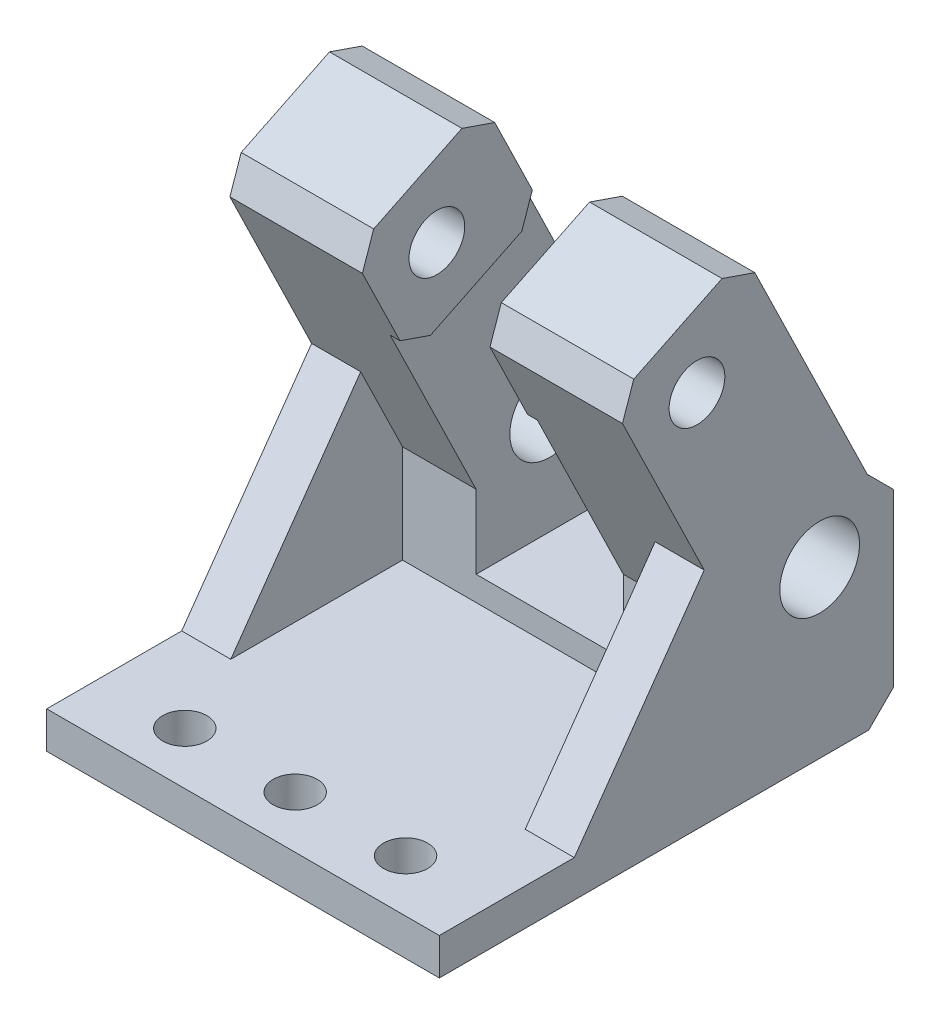
from build123d import *

# Parameters (mm, degrees)
EXTRUDE_1_DEPTH     = 12
SKETCH_2_W          = 32
SKETCH_2_H          = 3
EXTRUDE_2_DEPTH     = 25
SKETCH_3_R          = 3.25
CUT_EXTRUDE_1_DEPTH = 38
SKETCH_4_R          = 2.271913659
EXTRUDE_3_DEPTH     = 10
CHAMFER_2_SIZE      = 2
CHAMFER_3_SIZE      = 2
EXTRUDE_4_DEPTH     = 4
CHAMFER_4_SIZE      = 2
SKETCH_6_R          = 1.8
CUT_EXTRUDE_2_DEPTH = 8
EXTRUDE_5_DEPTH     = 0.8
SKETCH_8_R          = 2.271913659
CUT_EXTRUDE_3_DEPTH = 23


with BuildPart() as part:
    # 草图1 → 凸台-拉伸1 (new body)
    with BuildSketch(Plane.XY):
        Polygon((16, 0), (-16, 0), (-16, 18), (-6, 18), (-6, 5), (6, 5), (6, 18), (16, 18), align=None)
    extrude(amount=EXTRUDE_1_DEPTH)

    # 草图2 → 凸台-拉伸2 (add)
    with BuildSketch(Plane.XY.offset(12)):
        with Locations((0, 1.5)):
            Rectangle(SKETCH_2_W, SKETCH_2_H)
    extrude(amount=EXTRUDE_2_DEPTH)

    # 草图3 → 切除-拉伸1 (cut)
    with BuildSketch(Plane.ZY.offset(16)):
        with Locations((6, 13.5)):
            Circle(SKETCH_3_R)
    extrude(amount=-CUT_EXTRUDE_1_DEPTH, mode=Mode.SUBTRACT)

    # 草图4 → 凸台-拉伸3 (add)
    with BuildSketch(Plane.ZY.offset(16)):
        Polygon((2.061755591, 18), (12.158971032, 38.730393582), (22.947301651, 33.47568879), (12, 11), (12, 18), align=None)
        with Locations((16, 30.820508076)):
            Circle(SKETCH_4_R, mode=Mode.SUBTRACT)
    extrude_3 = extrude(amount=-EXTRUDE_3_DEPTH)

    # 镜向1: 凸台-拉伸3 across plane
    add(extrude_3.mirror(Plane(origin=(0, 0, 0), x_dir=(0, 0, 1), z_dir=(1, 0, 0))))

    # 倒角2
    chamfer_2_edges = [part.edges().sort_by_distance(p)[0] for p in [
        (11, 18, 0),
        (-11, 18, 0),
    ]]
    chamfer(chamfer_2_edges, length=CHAMFER_2_SIZE)

    # 倒角3
    chamfer_3_edges = [part.edges().sort_by_distance(p)[0] for p in [
        (-11, 38.730393582, 12.158971032),
        (-11, 33.47568879, 22.947301651),
        (11, 33.47568879, 22.947301651),
        (11, 38.730393582, 12.158971032),
    ]]
    chamfer(chamfer_3_edges, length=CHAMFER_3_SIZE)

    # 草图5 → 凸台-拉伸4 (add)
    with BuildSketch(Plane.ZY.offset(16)):
        Polygon((15.409511151, 18), (26, 3), (12, 3), (12, 11), align=None)
    extrude_4 = extrude(amount=-EXTRUDE_4_DEPTH)

    # 镜向2: 凸台-拉伸4 across plane
    add(extrude_4.mirror(Plane(origin=(0, 0, 0), x_dir=(0, 0, 1), z_dir=(1, 0, 0))))

    # 倒角4
    chamfer_4_edges = [part.edges().sort_by_distance(p)[0] for p in [
        (0, 0, 0),
    ]]
    chamfer(chamfer_4_edges, length=CHAMFER_4_SIZE)

    # 草图6 → 切除-拉伸2 (cut)
    with BuildSketch(Plane(origin=(0, 3, 0), x_dir=(1, 0, 0), z_dir=(0, 1, 0))):
        with Locations(Location((0, -32.750411326, 0), (0, 0, 270))):
            Circle(SKETCH_6_R)
        with Locations(Location((-9, -32.750411326, 0), (0, 0, 270))):
            Circle(SKETCH_6_R)
        with Locations(Location((9, -32.750411326, 0), (0, 0, 180))):
            Circle(SKETCH_6_R)
    extrude(amount=-CUT_EXTRUDE_2_DEPTH, mode=Mode.SUBTRACT)

    # 草图7 → 凸台-拉伸5 (add)
    with BuildSketch(Plane.ZY.offset(-6)):
        Polygon((11.2831869, 36.932338479), (13.957026135, 37.85460945), (21.149246548, 34.351472922), (22.071517519, 31.677633686), (19.006273057, 25.384440825), (16.525669772, 24.528821546), (9.073561717, 28.158542333), (8.217942438, 30.639145618), align=None)
    extrude_5 = extrude(amount=EXTRUDE_5_DEPTH)

    # 镜向3: 凸台-拉伸5 across plane
    add(extrude_5.mirror(Plane(origin=(0, 0, 0), x_dir=(0, 0, 1), z_dir=(1, 0, 0))))

    # 草图8 → 切除-拉伸3 (cut)
    with BuildSketch(Plane.ZY.offset(6)):
        with Locations((16, 30.820508076)):
            Circle(SKETCH_8_R)
    extrude(amount=-CUT_EXTRUDE_3_DEPTH, mode=Mode.SUBTRACT)


solid = part.part
